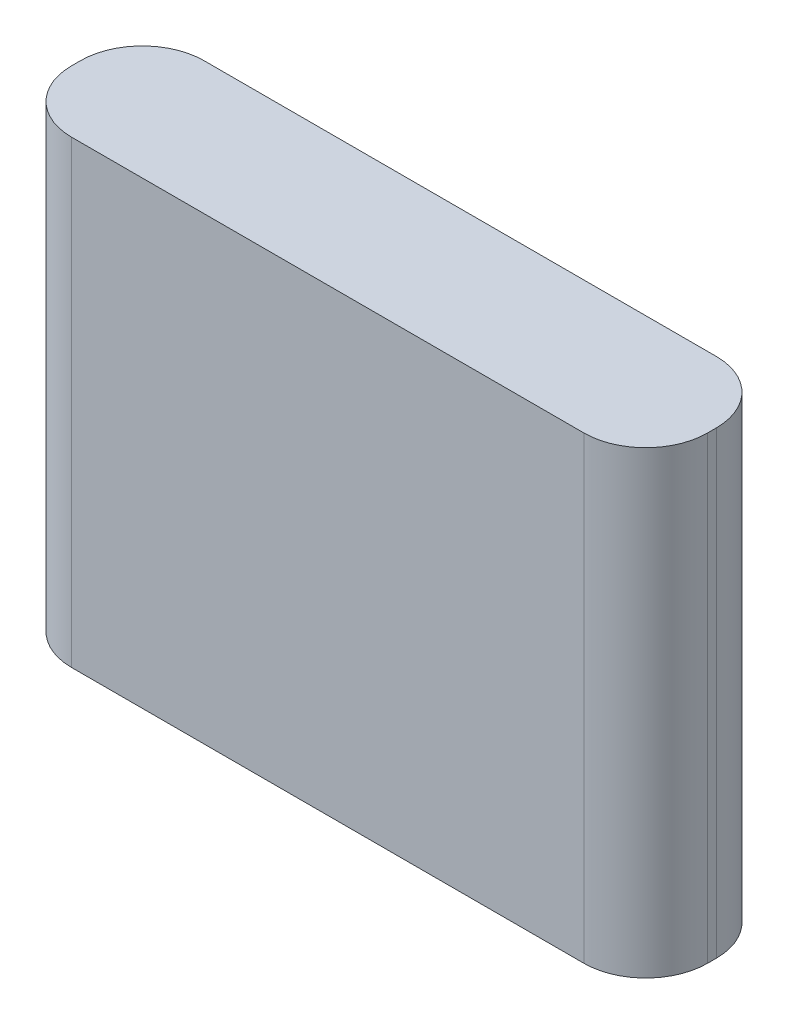
from build123d import *

# Parameters (mm, degrees)
ESQUISSE1_W        = 72
ESQUISSE1_H        = 52
BOSS_EXTRU_1_DEPTH = 15
CONG_1_R           = 7


with BuildPart() as part:
    # Esquisse1 → Boss.-Extru.1 (new body)
    with BuildSketch(Plane.XY):
        with Locations((36, 26)):
            Rectangle(ESQUISSE1_W, ESQUISSE1_H)
    extrude(amount=BOSS_EXTRU_1_DEPTH)

    # Congé1
    cong_1_edges = [part.edges().sort_by_distance(p)[0] for p in [
        (72, 26, 15),
        (0, 26, 15),
        (72, 26, 0),
        (0, 26, 0),
    ]]
    fillet(cong_1_edges, radius=CONG_1_R)


solid = part.part
